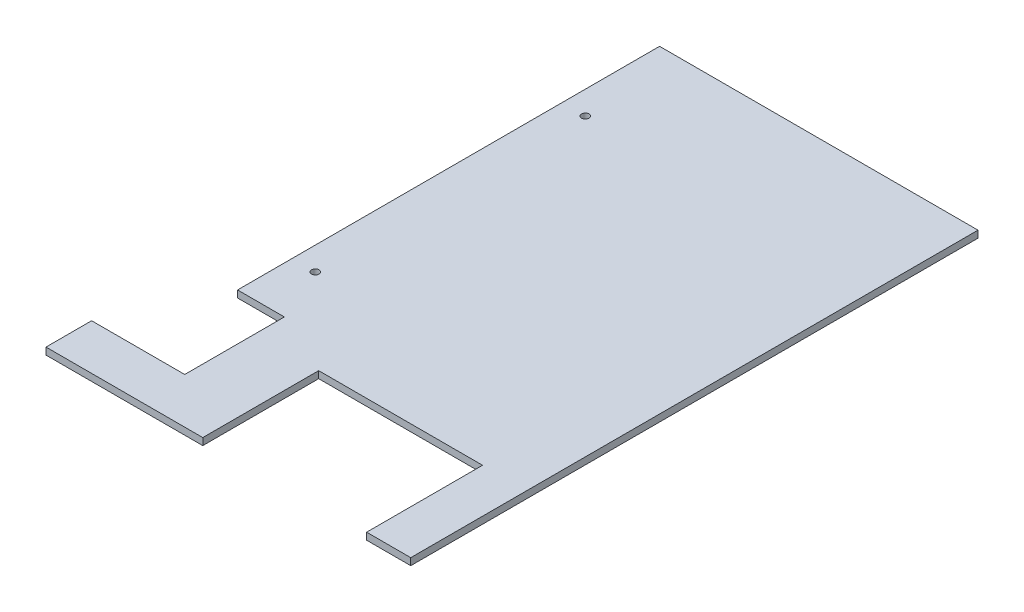
from build123d import *

# Parameters (mm, degrees)
SKETCH1_R           = 1.6
BOSS_EXTRUDE1_DEPTH = 3
SKETCH2_W           = 19.6
SKETCH2_H           = 3
BOSS_EXTRUDE2_DEPTH = 40


with BuildPart() as part:
    # Sketch1 → Boss-Extrude1 (new body)
    with BuildSketch(Plane.XZ.offset(561.298939869)):
        Polygon((-11.110843614, 789.420141885), (16.239156386, 789.420141885), (16.239156386, 739.620141885), (86.639156386, 739.620141885), (86.639156386, 789.420141885), (105.589156386, 789.420141885), (105.589156386, 545.720141885), (-31.210843614, 545.720141885), (-31.210843614, 727.020141885), (-11.110843614, 727.020141885), align=None)
        with Locations((-21.210843614, 703.620141885)):
            Circle(SKETCH1_R, mode=Mode.SUBTRACT)
        with Locations((-21.210843614, 587.620141885)):
            Circle(SKETCH1_R, mode=Mode.SUBTRACT)
    extrude(amount=BOSS_EXTRUDE1_DEPTH)

    # Sketch2 → Boss-Extrude2 (add)
    with BuildSketch(Plane.ZY.offset(11.110843614)):
        with Locations((779.620141885, -562.798939869)):
            Rectangle(SKETCH2_W, SKETCH2_H)
    extrude(amount=BOSS_EXTRUDE2_DEPTH)


solid = part.part
